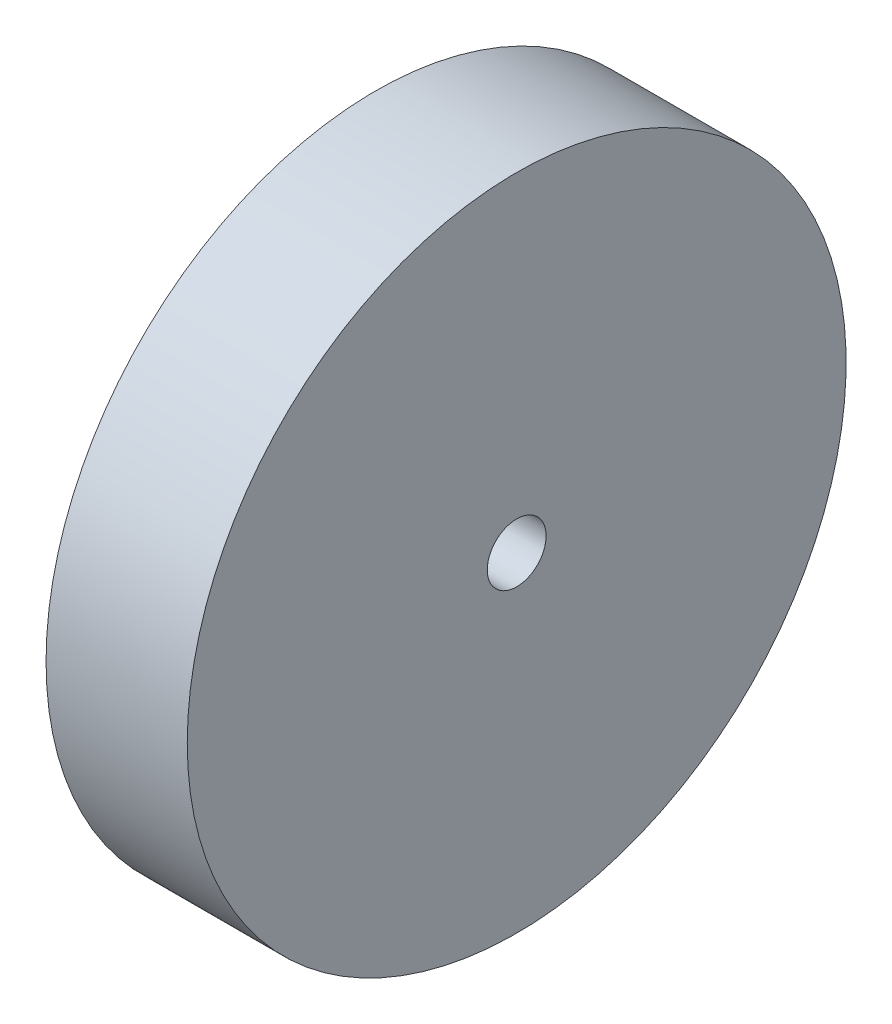
from build123d import *

# Parameters (mm, degrees)
SKETCH_1_W          = 12
SKETCH_1_H          = 28
SKETCH_2_R          = 2.5
CUT_EXTRUDE_1_DEPTH = 42.376321731


with BuildPart() as part:
    # 草图1 → 旋转1 (revolve)
    with BuildSketch(Plane.XY, mode=Mode.PRIVATE) as revolve_1_sk:
        with Locations((0, -14)):
            Rectangle(SKETCH_1_W, SKETCH_1_H)
    revolve(revolve_1_sk.sketch.rotate(Axis((-16.710917891, 0, 0), (1, 0, 0)), 270), axis=Axis((-16.710917891, 0, 0), (1, 0, 0)))

    # 草图2 → 切除-拉伸1 (cut, through all)
    with BuildSketch(Plane.ZY.offset(6)):
        Circle(SKETCH_2_R)
    extrude(amount=-CUT_EXTRUDE_1_DEPTH, mode=Mode.SUBTRACT)


solid = part.part
